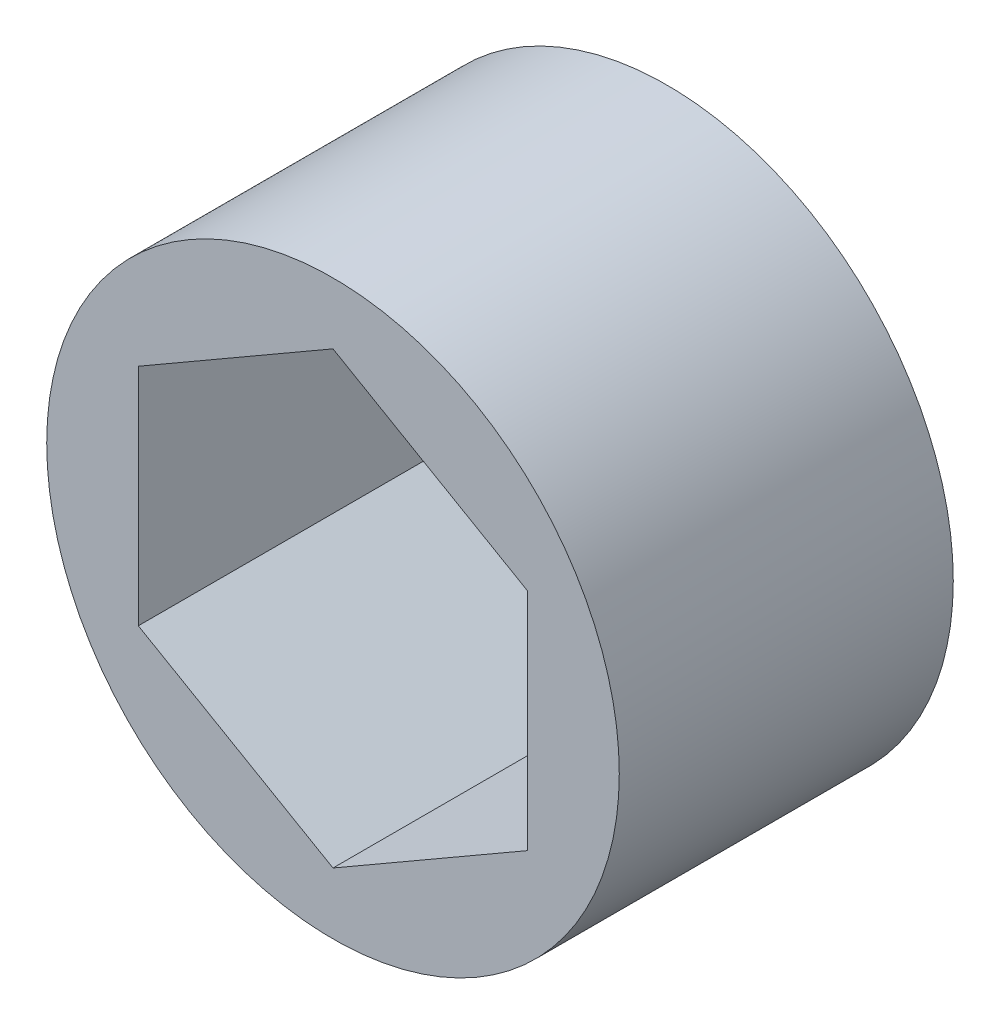
from build123d import *

# Parameters (mm, degrees)
SKETCH1_R           = 9.525
BOSS_EXTRUDE1_DEPTH = 5.55625


with BuildPart() as part:
    # Sketch1 → Boss-Extrude1 (new, symmetric)
    with BuildSketch(Plane.XY):
        Circle(SKETCH1_R)
        Polygon((0, 7.478995387), (-6.477, 3.739497694), (-6.477, -3.739497694), (0, -7.478995387), (6.477, -3.739497694), (6.477, 3.739497694), align=None, mode=Mode.SUBTRACT)
    extrude(amount=BOSS_EXTRUDE1_DEPTH, both=True)


solid = part.part
